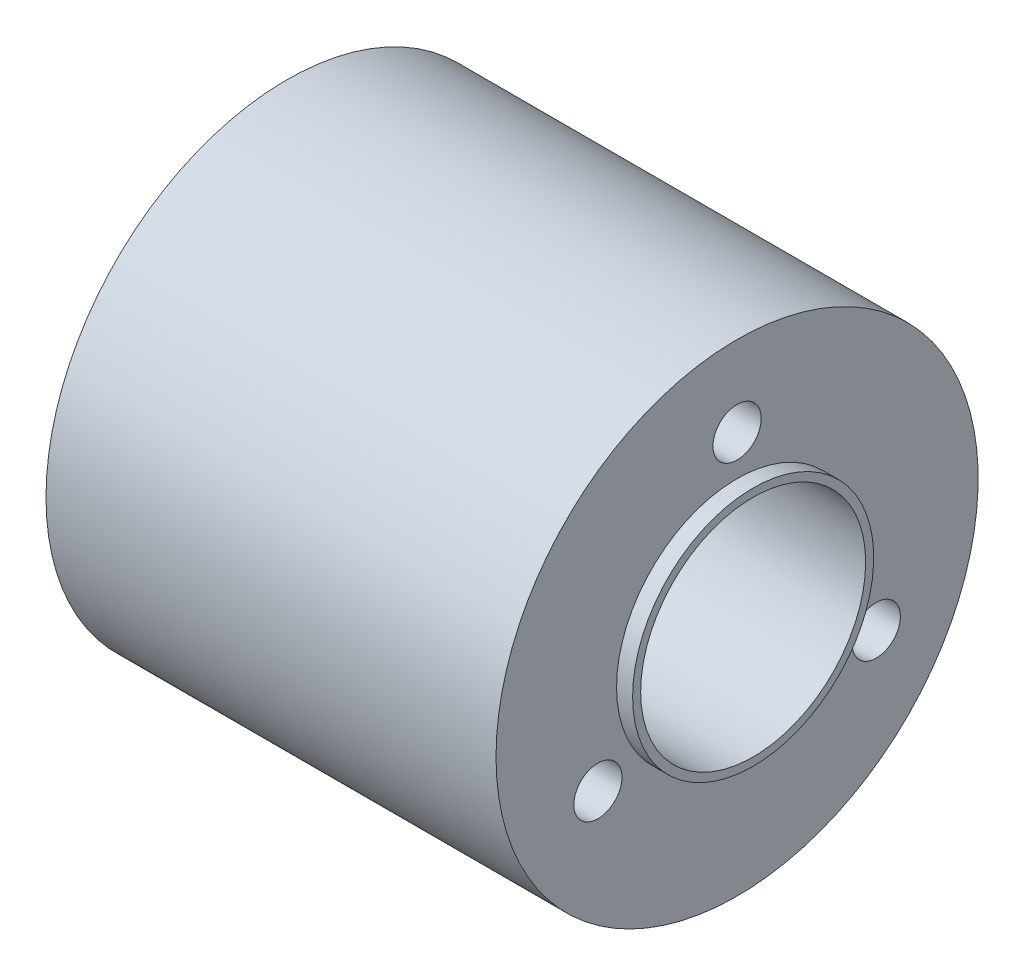
from build123d import *

# Parameters (mm, degrees)
CUT_EXTRUDE1_REACH = 37.93
SKETCH3_R          = 1.5
CIRPATTERN1_COUNT  = 3


with BuildPart() as part:
    # Sketch2 → Revolve1 (revolve)
    with BuildSketch(Plane.XY, mode=Mode.PRIVATE) as revolve1_sk:
        Polygon((0, 15), (28, 15), (28, 7.5), (29, 7.5), (29, 7), (0, 7), align=None)
    revolve(revolve1_sk.sketch.rotate(Axis((0, 0, 0), (1, 0, 0)), 90), axis=Axis((0, 0, 0), (1, 0, 0)))

    # Sketch3 → Cut-Extrude1 (cut, up to next)
    with BuildSketch(Plane.ZY, mode=Mode.PRIVATE) as cut_extrude1_sk1:
        with Locations((0, 10)):
            Circle(SKETCH3_R)
    cut_extrude1_tool1 = extrude(cut_extrude1_sk1.sketch, amount=-CUT_EXTRUDE1_REACH, mode=Mode.PRIVATE) & part.part
    cut_extrude1 = cut_extrude1_tool1.solids().sort_by_distance((0, 10, 0))[0]
    add(cut_extrude1, mode=Mode.SUBTRACT)

    # CirPattern1: Cut-Extrude1 ×3 about axis
    cirpattern1_axis = Axis((0, 0, 0), (1, 0, 0))
    for i in range(1, CIRPATTERN1_COUNT):
        add(cut_extrude1.rotate(cirpattern1_axis, i * 360 / CIRPATTERN1_COUNT), mode=Mode.SUBTRACT)


solid = part.part
